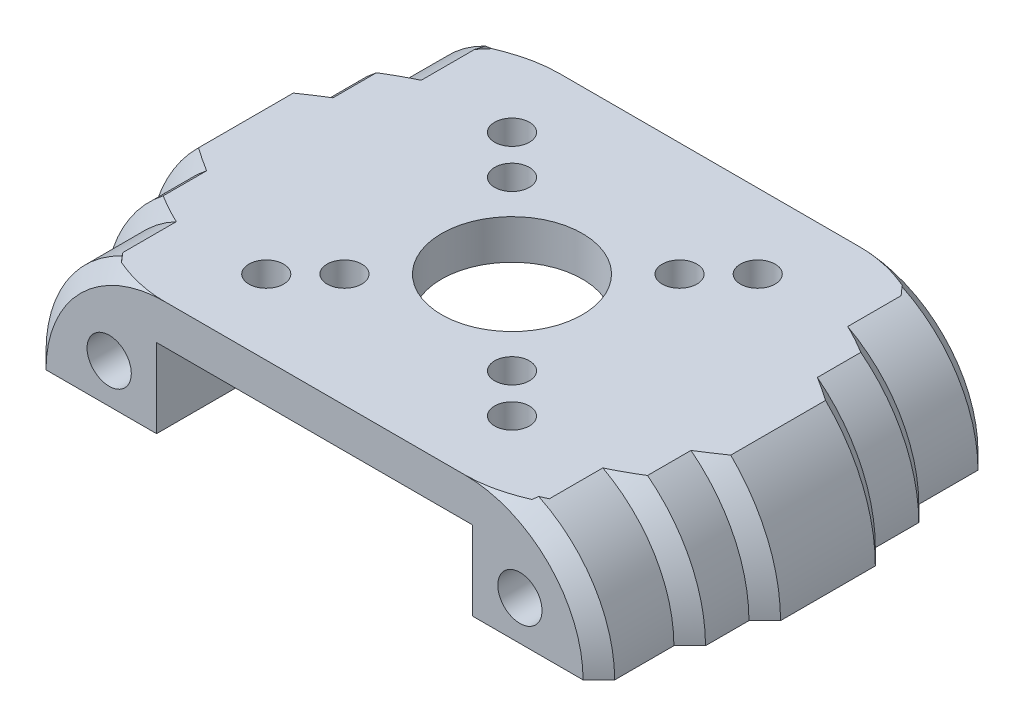
from build123d import *

# Parameters (mm, degrees)
BOSS_EXTRUDE1_DEPTH     = 50
SKETCH5_W               = 40
SKETCH5_H               = 50
CUT_EXTRUDE4_DEPTH      = 10
SKETCH6_R               = 7.5
CUT_EXTRUDE5_DEPTH      = 15
CUT_EXTRUDE6_DEPTH      = 65.007812023
CUT_EXTRUDE6_DEPTH_BACK = 65.007812023
SKETCH7_R               = 2.8
SKETCH8_R               = 8.913017029
SKETCH8_R_2             = 2.2
CUT_EXTRUDE7_DEPTH      = 10
SKETCH12_R              = 35
CUT_EXTRUDE8_DEPTH      = 6


with BuildPart() as part:
    # Sketch1 → Boss-Extrude1 (new body)
    with BuildSketch(Plane.XY):
        with BuildLine():
            Line((34, 6), (-34, 6))
            ThreePointArc((-34, 6), (-29.606601718, 16.606601718), (-19, 21))
            Line((-19, 21), (19, 21))
            ThreePointArc((19, 21), (29.606601718, 16.606601718), (34, 6))
        make_face()
    extrude(amount=BOSS_EXTRUDE1_DEPTH)

    # Sketch5 → Cut-Extrude4 (cut)
    with BuildSketch(Plane.XZ.offset(-6)):
        with Locations((0, 25)):
            Rectangle(SKETCH5_W, SKETCH5_H)
    extrude(amount=-CUT_EXTRUDE4_DEPTH, mode=Mode.SUBTRACT)

    # Sketch6 → Cut-Extrude5 (cut)
    with BuildSketch(Plane(origin=(0, 21, 0), x_dir=(1, 0, 0), z_dir=(0, 1, 0))):
        with Locations(Location((0, -25, 0), (0, 0, 270))):
            Circle(SKETCH6_R)
    extrude(amount=-CUT_EXTRUDE5_DEPTH, mode=Mode.SUBTRACT)

    # Sketch7 → Cut-Extrude6 (cut, two sides: drawn at the far end of the back side and taken through both)
    with BuildSketch(Plane.XY.offset(50).offset(-CUT_EXTRUDE6_DEPTH_BACK)):
        with Locations((-26, 11)):
            Circle(SKETCH7_R)
        with Locations((26, 11)):
            Circle(SKETCH7_R)
    extrude(amount=CUT_EXTRUDE6_DEPTH + CUT_EXTRUDE6_DEPTH_BACK, mode=Mode.SUBTRACT)

    # Sketch8 → Cut-Extrude7 (cut)
    with BuildSketch(Plane(origin=(0, 21, 0), x_dir=(1, 0, 0), z_dir=(0, 1, 0))):
        with Locations(Location((0, -25, 0), (0, 0, 180))):
            Circle(SKETCH8_R)
        with Locations(Location((10.606601718, -14.393398282, 0), (0, 0, 180))):
            Circle(SKETCH8_R_2)
        with Locations(Location((15.556349186, -9.443650814, 0), (0, 0, 180))):
            Circle(SKETCH8_R_2)
        with Locations(Location((-10.606601718, -14.393398282, 0), (0, 0, 180))):
            Circle(SKETCH8_R_2)
        with Locations(Location((-15.556349186, -9.443650814, 0), (0, 0, 180))):
            Circle(SKETCH8_R_2)
        with Locations(Location((-10.606601718, -35.606601718, 0), (0, 0, 180))):
            Circle(SKETCH8_R_2)
        with Locations(Location((-15.556349186, -40.556349186, 0), (0, 0, 180))):
            Circle(SKETCH8_R_2)
        with Locations(Location((10.606601718, -35.606601718, 0), (0, 0, 180))):
            Circle(SKETCH8_R_2)
        with Locations(Location((15.556349186, -40.556349186, 0), (0, 0, 180))):
            Circle(SKETCH8_R_2)
    extrude(amount=-CUT_EXTRUDE7_DEPTH, mode=Mode.SUBTRACT)

    # Sweep2: sweep along a path in Sketch11
    with BuildLine(Plane(origin=(0, 0, 0), x_dir=(-1, 0, 0), z_dir=(0, 0, -1))) as sweep2_path:
        ThreePointArc((-34, 6), (-29.606601718, 16.606601718), (-19, 21))
        Line((-19, 21), (19, 21))
        ThreePointArc((19, 21), (29.606601718, 16.606601718), (34, 6))
    # Sketch9 → Sweep2 (sweep)
    with BuildSketch(Plane.XZ.offset(-6)):
        Polygon((34, 0), (36, 2), (36, 9.5), (38, 11.5), (38, 17), (40, 19), (40, 31), (38, 33), (38, 38.5), (36, 40.5), (36, 48), (34, 50), align=None)
    sweep(path=sweep2_path.line)

    # Sketch12 → Cut-Extrude8 (cut)
    with BuildSketch(Plane(origin=(0, 27, 0), x_dir=(1, 0, 0), z_dir=(0, 1, 0))):
        with Locations((0, -25)):
            Circle(SKETCH12_R)
    extrude(amount=-CUT_EXTRUDE8_DEPTH, mode=Mode.SUBTRACT)


solid = part.part
